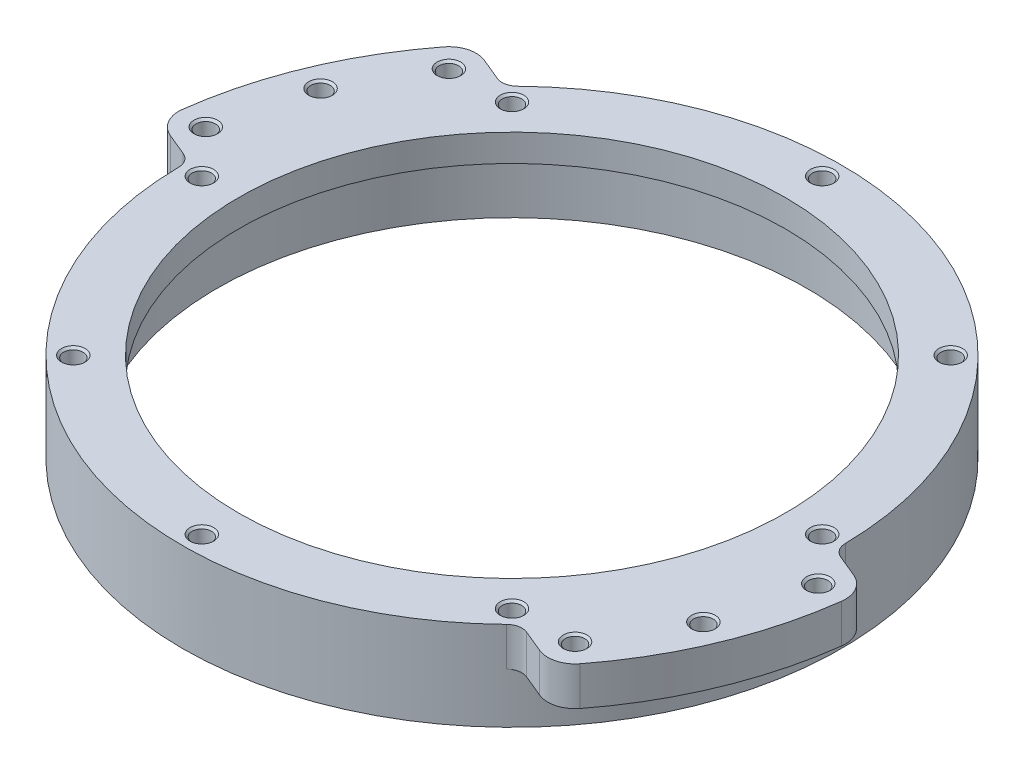
from build123d import *

# Parameters (mm, degrees)
SKETCH_1_R                   = 42.5
SKETCH_1_R_2                 = 38
EXTRUDE_1_DEPTH              = 11.5
EXTRUDE_START                = -3.5
SKETCH_2_R                   = 38
SKETCH_2_R_2                 = 35.25
EXTRUDE_2_DEPTH              = 3.5
SKETCH_3_R                   = 1
CUT_EXTRUDE_1_DEPTH          = 62.194362485
EXTRUDE_START_2              = -5
SKETCH_5_R                   = 1.15
EXTRUDE_3_DEPTH              = 5
FILLET_1_R                   = 2
HOLE_WIZARD_M3_1_D           = 2.5
HOLE_WIZARD_M3_1_CSINK_D     = 3.05
HOLE_WIZARD_M3_1_CSINK_ANGLE = 90
HOLE_WIZARD_M3_2_D           = 2.5
HOLE_WIZARD_M3_2_CSINK_D     = 3.05
HOLE_WIZARD_M3_2_CSINK_ANGLE = 90


with BuildPart() as part:
    # 草图1 → 凸台-拉伸1 (new body)
    with BuildSketch(Plane(origin=(0, 0, 0), x_dir=(1, 0, 0), z_dir=(0, 1, 0))):
        with Locations(Location((0, 0, 0), (0, 0, 270))):
            Circle(SKETCH_1_R)
        with Locations(Location((0, 0, 0), (0, 0, 270))):
            Circle(SKETCH_1_R_2, mode=Mode.SUBTRACT)
    extrude(amount=EXTRUDE_1_DEPTH)

    # 草图2 → 凸台-拉伸2 (add)
    with BuildSketch(Plane(origin=(0, 11.5, 0), x_dir=(1, 0, 0), z_dir=(0, 1, 0)).offset(EXTRUDE_START)):
        with Locations(Location((0, 0, 0), (0, 0, 270))):
            Circle(SKETCH_2_R)
        with Locations(Location((0, 0, 0), (0, 0, 270))):
            Circle(SKETCH_2_R_2, mode=Mode.SUBTRACT)
    extrude(amount=EXTRUDE_2_DEPTH)

    # 草图3 → 切除-拉伸1 (cut, through all)
    with BuildSketch(Plane.XZ):
        with Locations(Location((0, -40, 0), (0, 0, 270))):
            Circle(SKETCH_3_R)
        with Locations(Location((-28.284271247, -28.284271247, 0), (0, 0, 270))):
            Circle(SKETCH_3_R)
        with Locations(Location((-40, 0, 0), (0, 0, 270))):
            Circle(SKETCH_3_R)
        with Locations(Location((-28.284271247, 28.284271247, 0), (0, 0, 270))):
            Circle(SKETCH_3_R)
        with Locations(Location((0, 40, 0), (0, 0, 270))):
            Circle(SKETCH_3_R)
        with Locations(Location((28.284271247, 28.284271247, 0), (0, 0, 270))):
            Circle(SKETCH_3_R)
        with Locations(Location((40, 0, 0), (0, 0, 270))):
            Circle(SKETCH_3_R)
        with Locations(Location((28.284271247, -28.284271247, 0), (0, 0, 270))):
            Circle(SKETCH_3_R)
    extrude(amount=-CUT_EXTRUDE_1_DEPTH, mode=Mode.SUBTRACT)

    # 草图5 → 凸台-拉伸3 (add)
    # profile 1 of 2: a face of its own
    with BuildSketch(Plane(origin=(0, 11.5, 0), x_dir=(1, 0, 0), z_dir=(0, 1, 0)).offset(EXTRUDE_START_2)):
        with BuildLine():
            Line((34.719106229, -31.158203778), (30.628830889, -29.463956258))
            ThreePointArc((30.628830889, -29.463956258), (39.264880132, -16.264045876), (42.492017292, -0.82369075))
            Line((42.492017292, -0.82369075), (46.582292632, -2.51793827))
            ThreePointArc((46.582292632, -2.51793827), (48.270085945, -3.99477277), (48.714957389, -6.19290284))
            ThreePointArc((48.714957389, -6.19290284), (45.368967913, -18.79244182), (38.825720309, -30.067633122))
            ThreePointArc((38.825720309, -30.067633122), (36.956836015, -31.307374185), (34.719106229, -31.158203778))
        make_face()
        with Locations(Location((36.058498242, -27.924625414, 0), (0, 0, 270))):
            Circle(SKETCH_5_R, mode=Mode.SUBTRACT)
        with Locations(Location((45.242900619, -5.751516634, 0), (0, 0, 270))):
            Circle(SKETCH_5_R, mode=Mode.SUBTRACT)
        with Locations(Location((42.135389549, -17.453049807, 0), (0, 0, 270))):
            Circle(SKETCH_5_R, mode=Mode.SUBTRACT)
    # profile 2 of 2: a face of its own
    with BuildSketch(Plane(origin=(0, 11.5, 0), x_dir=(1, 0, 0), z_dir=(0, 1, 0)).offset(EXTRUDE_START_2)):
        with BuildLine():
            Line((-34.719106229, 31.158203778), (-30.628830889, 29.463956258))
            ThreePointArc((-30.628830889, 29.463956258), (-39.264880132, 16.264045876), (-42.492017292, 0.82369075))
            Line((-42.492017292, 0.82369075), (-46.582292632, 2.51793827))
            ThreePointArc((-46.582292632, 2.51793827), (-48.270085945, 3.99477277), (-48.714957389, 6.19290284))
            ThreePointArc((-48.714957389, 6.19290284), (-45.368967913, 18.79244182), (-38.825720309, 30.067633122))
            ThreePointArc((-38.825720309, 30.067633122), (-36.956836015, 31.307374185), (-34.719106229, 31.158203778))
        make_face()
        with Locations(Location((-36.058498242, 27.924625414, 0), (0, 0, 270))):
            Circle(SKETCH_5_R, mode=Mode.SUBTRACT)
        with Locations(Location((-45.242900619, 5.751516634, 0), (0, 0, 270))):
            Circle(SKETCH_5_R, mode=Mode.SUBTRACT)
        with Locations(Location((-42.135389549, 17.453049807, 0), (0, 0, 270))):
            Circle(SKETCH_5_R, mode=Mode.SUBTRACT)
    extrude(amount=EXTRUDE_3_DEPTH)

    # 圆角1
    fillet_1_edges = [part.edges().sort_by_distance(p)[0] for p in [
        (30.628830889, 9, 29.463956258),
        (42.492017292, 9, 0.82369075),
        (-30.628830889, 9, -29.463956258),
        (-42.492017292, 9, -0.82369075),
    ]]
    fillet(fillet_1_edges, radius=FILLET_1_R)

    # M3 螺纹孔1 (through all)
    with Locations(Plane(origin=(40, 11.5, 0), x_dir=(0, 0, 1), z_dir=(0, 1, 0))):
        with Locations((0, 0), (-28.284271247, -11.715728753), (-40, -40), (-28.284271247, -68.284271247), (0, -80), (28.284271247, -68.284271247), (17.453049807, 2.135389549), (5.751516634, 5.242900619), (-5.751516634, -85.242900619), (-17.453049807, -82.135389549), (-27.924625414, -76.058498242)):
            CounterSinkHole(HOLE_WIZARD_M3_1_D / 2, HOLE_WIZARD_M3_1_CSINK_D / 2, counter_sink_angle=HOLE_WIZARD_M3_1_CSINK_ANGLE)

    # M3 螺纹孔2 (through all)
    with Locations(Plane(origin=(36.058498242, 11.5, 27.924625414), x_dir=(0, 0, 1), z_dir=(0, 1, 0))):
        with Locations((0, 0), (0.359645833, -7.774226995), (12.075374586, -36.058498242)):
            CounterSinkHole(HOLE_WIZARD_M3_2_D / 2, HOLE_WIZARD_M3_2_CSINK_D / 2, counter_sink_angle=HOLE_WIZARD_M3_2_CSINK_ANGLE)


solid = part.part
